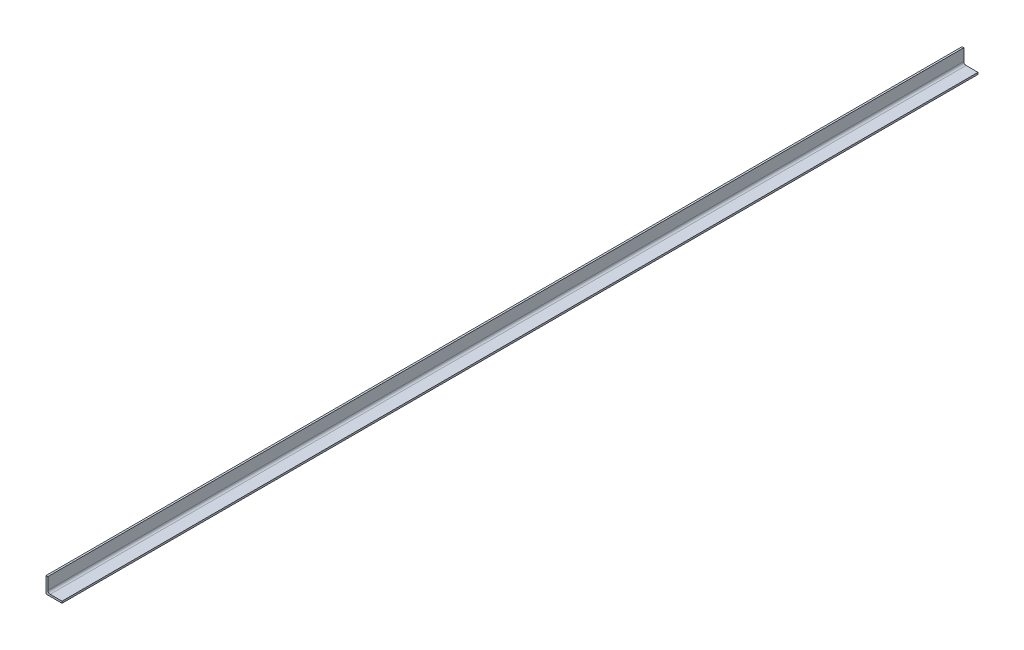
from build123d import *

# Parameters (mm, degrees)
BOSS_EXTRU_1_DEPTH = 2000
CONG_1_R           = 5


with BuildPart() as part:
    # Esquisse1 → Boss.-Extru.1 (new body)
    with BuildSketch(Plane.XY):
        Polygon((0, 0), (0, 35), (4, 35), (4, 4), (35, 4), (35, 0), align=None)
    extrude(amount=BOSS_EXTRU_1_DEPTH)

    # Congé1
    cong_1_edges = [part.edges().sort_by_distance(p)[0] for p in [
        (4, 4, 1000),
    ]]
    fillet(cong_1_edges, radius=CONG_1_R)


solid = part.part
